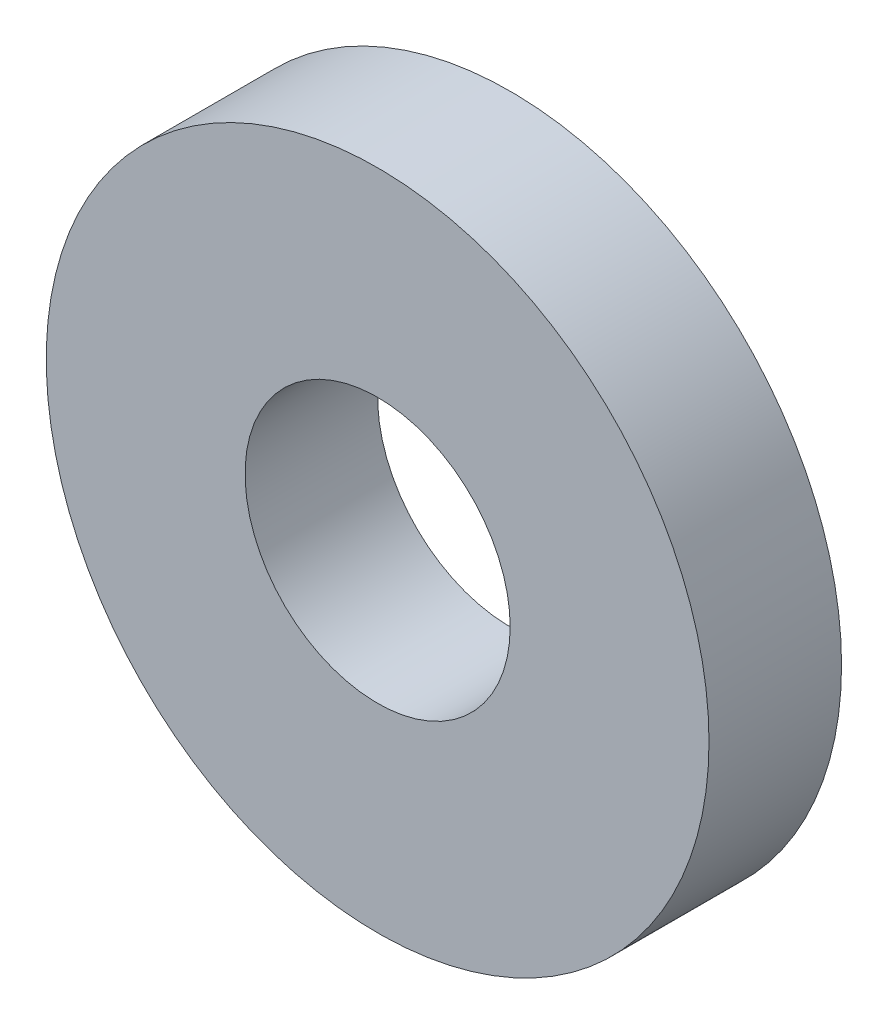
from build123d import *

# Parameters (mm, degrees)
SKETCH5_R           = 25
SKETCH5_R_2         = 10
BOSS_EXTRUDE1_DEPTH = 10


with BuildPart() as part:
    # Sketch5 → Boss-Extrude1 (new body)
    with BuildSketch(Plane.XY):
        Circle(SKETCH5_R)
        Circle(SKETCH5_R_2, mode=Mode.SUBTRACT)
    extrude(amount=BOSS_EXTRUDE1_DEPTH)


solid = part.part
